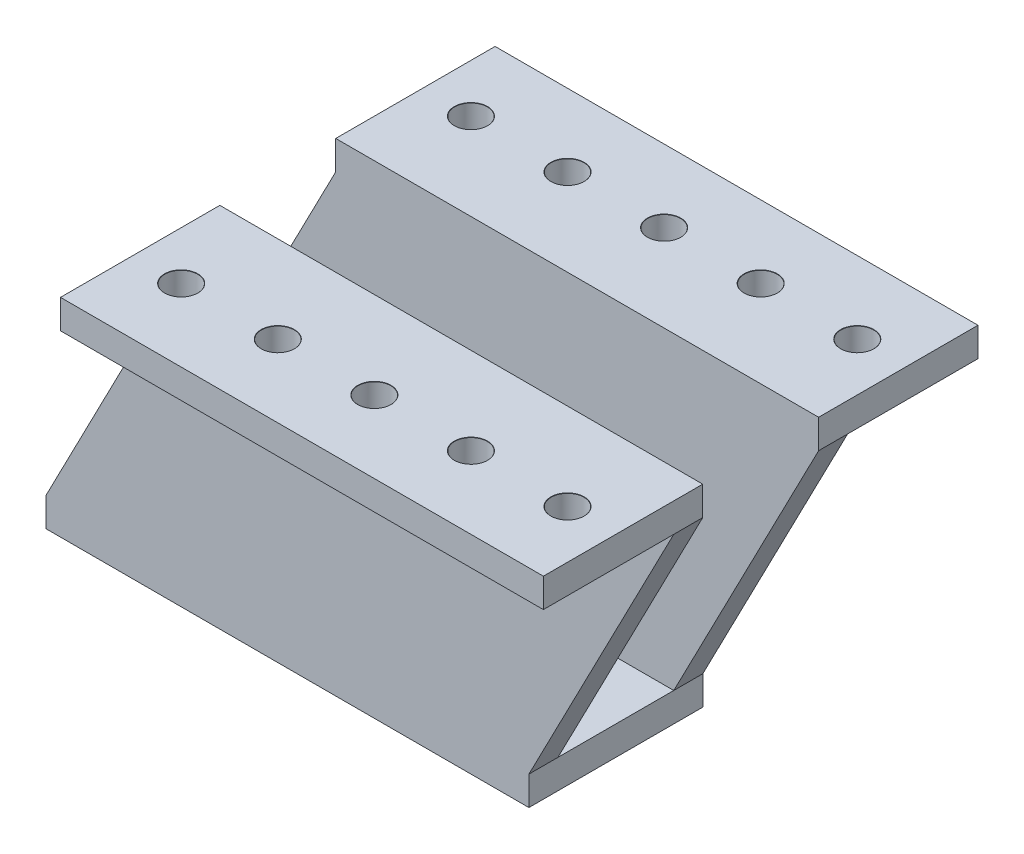
from build123d import *

# Parameters (mm, degrees)
SKETCH1_W                      = 49.9999
SKETCH1_H                      = 14.9999999
BOSS_EXTRUDE1_DEPTH            = 3
BOSS_EXTRUDE2_START            = 35
SKETCH1_3_W                    = 49.9999
SKETCH1_3_H                    = 14.9999999
BOSS_EXTRUDE2_DEPTH            = 3
BOSS_EXTRUDE2_2_DEPTH          = 3
M3_CLEARANCE_HOLE1_AT_2_COUNT  = 2
M3_CLEARANCE_HOLE1_AT_2_PITCH  = 36.055512588
M3_CLEARANCE_HOLE1_AT_3_COUNT  = 2
M3_CLEARANCE_HOLE1_AT_3_PITCH  = 20
M3_CLEARANCE_HOLE1_AT_4_COUNT  = 2
M3_CLEARANCE_HOLE1_AT_4_PITCH  = 42.42640673
M3_CLEARANCE_HOLE1_AT_5_COUNT  = 2
M3_CLEARANCE_HOLE1_AT_5_PITCH  = 30
M3_CLEARANCE_HOLE1_AT_6_COUNT  = 2
M3_CLEARANCE_HOLE1_AT_6_PITCH  = 49.99999988
M3_CLEARANCE_HOLE1_AT_7_COUNT  = 2
M3_CLEARANCE_HOLE1_AT_7_PITCH  = 40
M3_CLEARANCE_HOLE1_AT_8_COUNT  = 2
M3_CLEARANCE_HOLE1_AT_8_PITCH  = 31.622776412
M3_CLEARANCE_HOLE1_AT_9_COUNT  = 2
M3_CLEARANCE_HOLE1_AT_9_PITCH  = 10
M3_CLEARANCE_HOLE1_AT_10_COUNT = 2
M3_CLEARANCE_HOLE1_AT_10_PITCH = 29.9999998
M3_CLEARANCE_HOLE2_AT_2_COUNT  = 2
M3_CLEARANCE_HOLE2_AT_2_PITCH  = 20
M3_CLEARANCE_HOLE2_AT_3_COUNT  = 2
M3_CLEARANCE_HOLE2_AT_3_PITCH  = 30
M3_CLEARANCE_HOLE2_AT_4_COUNT  = 2
M3_CLEARANCE_HOLE2_AT_4_PITCH  = 40
M3_CLEARANCE_HOLE2_AT_5_COUNT  = 2
M3_CLEARANCE_HOLE2_AT_5_PITCH  = 10
BOSS_EXTRUDE3_DEPTH            = 1.5
BOSS_EXTRUDE3_DEPTH_BACK       = 1.5
BOSS_EXTRUDE4_DEPTH            = 1.5
BOSS_EXTRUDE4_DEPTH_BACK       = 1.5
BOSS_EXTRUDE4_START            = -15


with BuildPart() as part:
    # Sketch1 → Boss-Extrude1 (new body)
    with BuildSketch(Plane(origin=(0, 0, 0), x_dir=(1, 0, 0), z_dir=(0, 1, 0))):
        with Locations((24.99995, 22.49999985)):
            Rectangle(SKETCH1_W, SKETCH1_H)
    extrude(amount=BOSS_EXTRUDE1_DEPTH)

    # Sketch8 → M3 Clearance Hole2 (revolve, cut)
    with BuildSketch(Plane(origin=(4.99995, 3, -22.49999985), x_dir=(0, 0, 1), z_dir=(1, 0, 0))):
        Polygon((0, 0), (0, 3), (1.7, 3), (1.7, 0.025), (1.725, 0), align=None)
    m3_clearance_hole2 = revolve(axis=Axis((4.99995, 9.35, -22.49999985), (0, -1, 0)), mode=Mode.SUBTRACT)

    # M3 Clearance Hole2 at 2: M3 Clearance Hole2 ×2
    with Locations(*[(i * M3_CLEARANCE_HOLE2_AT_2_PITCH, 0, 0) for i in range(1, M3_CLEARANCE_HOLE2_AT_2_COUNT)]):
        add(m3_clearance_hole2, mode=Mode.SUBTRACT)

    # M3 Clearance Hole2 at 3: M3 Clearance Hole2 ×2
    with Locations(*[(i * M3_CLEARANCE_HOLE2_AT_3_PITCH, 0, 0) for i in range(1, M3_CLEARANCE_HOLE2_AT_3_COUNT)]):
        add(m3_clearance_hole2, mode=Mode.SUBTRACT)

    # M3 Clearance Hole2 at 4: M3 Clearance Hole2 ×2
    with Locations(*[(i * M3_CLEARANCE_HOLE2_AT_4_PITCH, 0, 0) for i in range(1, M3_CLEARANCE_HOLE2_AT_4_COUNT)]):
        add(m3_clearance_hole2, mode=Mode.SUBTRACT)

    # M3 Clearance Hole2 at 5: M3 Clearance Hole2 ×2
    with Locations(*[(i * M3_CLEARANCE_HOLE2_AT_5_PITCH, 0, 0) for i in range(1, M3_CLEARANCE_HOLE2_AT_5_COUNT)]):
        add(m3_clearance_hole2, mode=Mode.SUBTRACT)



with BuildPart() as body_2:
    # Sketch1<3> → Boss-Extrude2 (new body)
    with BuildSketch(Plane(origin=(0, 0, 0), x_dir=(1, 0, 0), z_dir=(0, 1, 0)).offset(BOSS_EXTRUDE2_START)):
        with Locations((39.99895, 37.49999975)):
            Rectangle(SKETCH1_3_W, SKETCH1_3_H)
    extrude(amount=-BOSS_EXTRUDE2_DEPTH)


with BuildPart() as body_3:
    # Sketch1<3> → Boss-Extrude2 2 (new body)
    with BuildSketch(Plane(origin=(0, 0, 0), x_dir=(1, 0, 0), z_dir=(0, 1, 0)).offset(BOSS_EXTRUDE2_START)):
        with Locations((39.99895, 7.49999995)):
            Rectangle(SKETCH1_3_W, SKETCH1_3_H)
    extrude(amount=-BOSS_EXTRUDE2_2_DEPTH)

    # Sketch6 → M3 Clearance Hole1 (revolve, cut)
    with BuildSketch(Plane(origin=(19.99895, 35, -7.49999995), x_dir=(0, 0, 1), z_dir=(1, 0, 0))):
        Polygon((0, 0), (0, 35), (1.7, 35), (1.7, 0.025), (1.725, 0), align=None)
    m3_clearance_hole1 = revolve(axis=Axis((19.99895, 41.35, -7.49999995), (0, -1, 0)), mode=Mode.SUBTRACT)

    # M3 Clearance Hole1 at 3: M3 Clearance Hole1 ×2
    with Locations(*[(i * M3_CLEARANCE_HOLE1_AT_3_PITCH, 0, 0) for i in range(1, M3_CLEARANCE_HOLE1_AT_3_COUNT)]):
        add(m3_clearance_hole1, mode=Mode.SUBTRACT)

    # M3 Clearance Hole1 at 5: M3 Clearance Hole1 ×2
    with Locations(*[(i * M3_CLEARANCE_HOLE1_AT_5_PITCH, 0, 0) for i in range(1, M3_CLEARANCE_HOLE1_AT_5_COUNT)]):
        add(m3_clearance_hole1, mode=Mode.SUBTRACT)

    # M3 Clearance Hole1 at 7: M3 Clearance Hole1 ×2
    with Locations(*[(i * M3_CLEARANCE_HOLE1_AT_7_PITCH, 0, 0) for i in range(1, M3_CLEARANCE_HOLE1_AT_7_COUNT)]):
        add(m3_clearance_hole1, mode=Mode.SUBTRACT)

    # M3 Clearance Hole1 at 9: M3 Clearance Hole1 ×2
    with Locations(*[(i * M3_CLEARANCE_HOLE1_AT_9_PITCH, 0, 0) for i in range(1, M3_CLEARANCE_HOLE1_AT_9_COUNT)]):
        add(m3_clearance_hole1, mode=Mode.SUBTRACT)


with BuildPart() as body_2_1:
    add(body_2.part)

    # M3 Clearance Hole1 at 2: M3 Clearance Hole1 ×2
    with Locations(*[Vector(0.5547001987853687, 0, -0.832050292631084) * (i * M3_CLEARANCE_HOLE1_AT_2_PITCH) for i in range(1, M3_CLEARANCE_HOLE1_AT_2_COUNT)]):
        add(m3_clearance_hole1, mode=Mode.SUBTRACT)

    # M3 Clearance Hole1 at 4: M3 Clearance Hole1 ×2
    with Locations(*[Vector(0.7071067835435565, 0, -0.7071067788295387) * (i * M3_CLEARANCE_HOLE1_AT_4_PITCH) for i in range(1, M3_CLEARANCE_HOLE1_AT_4_COUNT)]):
        add(m3_clearance_hole1, mode=Mode.SUBTRACT)

    # M3 Clearance Hole1 at 6: M3 Clearance Hole1 ×2
    with Locations(*[Vector(0.8000000019199883, 0, -0.5999999974400156) * (i * M3_CLEARANCE_HOLE1_AT_6_PITCH) for i in range(1, M3_CLEARANCE_HOLE1_AT_6_COUNT)]):
        add(m3_clearance_hole1, mode=Mode.SUBTRACT)

    # M3 Clearance Hole1 at 8: M3 Clearance Hole1 ×2
    with Locations(*[Vector(0.3162277679141873, 0, -0.948683297418064) * (i * M3_CLEARANCE_HOLE1_AT_8_PITCH) for i in range(1, M3_CLEARANCE_HOLE1_AT_8_COUNT)]):
        add(m3_clearance_hole1, mode=Mode.SUBTRACT)

    # M3 Clearance Hole1 at 10: M3 Clearance Hole1 ×2
    with Locations(*[(0, 0, -i * M3_CLEARANCE_HOLE1_AT_10_PITCH) for i in range(1, M3_CLEARANCE_HOLE1_AT_10_COUNT)]):
        add(m3_clearance_hole1, mode=Mode.SUBTRACT)


with BuildPart() as part_1:
    add(part.part)

    add(body_3.part)  # Boss-Extrude3 merges body 3
    # Sketch2 → Boss-Extrude3 (add, two sides: drawn at the far end of the back side and taken through both)
    with BuildSketch(Plane.XY.offset(-14.9999999).offset(-BOSS_EXTRUDE3_DEPTH_BACK)):
        Polygon((0, 0), (49.9999, 0), (49.9999, 3), (64.9989, 32), (64.9989, 35), (14.999, 35), (14.999, 32), (0, 3), align=None)
    extrude(amount=BOSS_EXTRUDE3_DEPTH + BOSS_EXTRUDE3_DEPTH_BACK)


    add(body_2_1.part)  # Boss-Extrude4 merges body 2
    # Sketch2<2> → Boss-Extrude4 (add, two sides: drawn at the far end of the back side and taken through both)
    with BuildSketch(Plane.XY.offset(-14.9999999).offset(BOSS_EXTRUDE4_START - BOSS_EXTRUDE4_DEPTH_BACK)):
        Polygon((0, 0), (49.9999, 0), (49.9999, 3), (64.9989, 32), (64.9989, 35), (14.999, 35), (14.999, 32), (0, 3), align=None)
    extrude(amount=BOSS_EXTRUDE4_DEPTH + BOSS_EXTRUDE4_DEPTH_BACK)


solid = part_1.part
